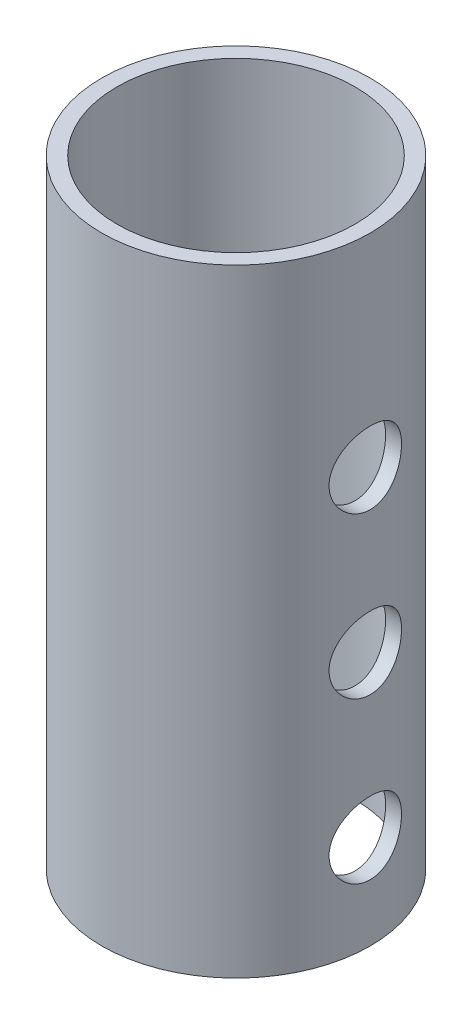
from build123d import *

# Parameters (mm, degrees)
SKETCH1_R           = 42.725
SKETCH1_R_2         = 37.875
BOSS_EXTRUDE1_DEPTH = 196.5
SKETCH2_R           = 11.53
CUT_EXTRUDE1_DEPTH  = 206.57991451
SKETCH4_R           = 7.5
CUT_EXTRUDE2_DEPTH  = 206.579914647


with BuildPart() as part:
    # Sketch1 → Boss-Extrude1 (new body)
    with BuildSketch(Plane(origin=(0, 0, 0), x_dir=(1, 0, 0), z_dir=(0, 1, 0))):
        with Locations(Location((0, 0, 0), (0, 0, 270))):
            Circle(SKETCH1_R)
        with Locations(Location((0, 0, 0), (0, 0, 270))):
            Circle(SKETCH1_R_2, mode=Mode.SUBTRACT)
    extrude(amount=BOSS_EXTRUDE1_DEPTH)

    # Sketch2 → Cut-Extrude1 (cut, through all)
    with BuildSketch(Plane(origin=(0, 0, 0), x_dir=(0, 0, -1), z_dir=(1, 0, 0))):
        with Locations(Location((0, 131.8, 0), (0, 0, 180))):
            Circle(SKETCH2_R)
        with Locations(Location((0, 80.8, 0), (0, 0, 180))):
            Circle(SKETCH2_R)
        with Locations(Location((0, 29.8, 0), (0, 0, 180))):
            Circle(SKETCH2_R)
    extrude(amount=CUT_EXTRUDE1_DEPTH, mode=Mode.SUBTRACT)

    # Sketch4 → Cut-Extrude2 (cut, through all)
    with BuildSketch(Plane(origin=(0, 0, 0), x_dir=(0, 0, -1), z_dir=(1, 0, 0))):
        with Locations((0, 106.3)):
            Circle(SKETCH4_R)
    extrude(amount=-CUT_EXTRUDE2_DEPTH, mode=Mode.SUBTRACT)


solid = part.part
